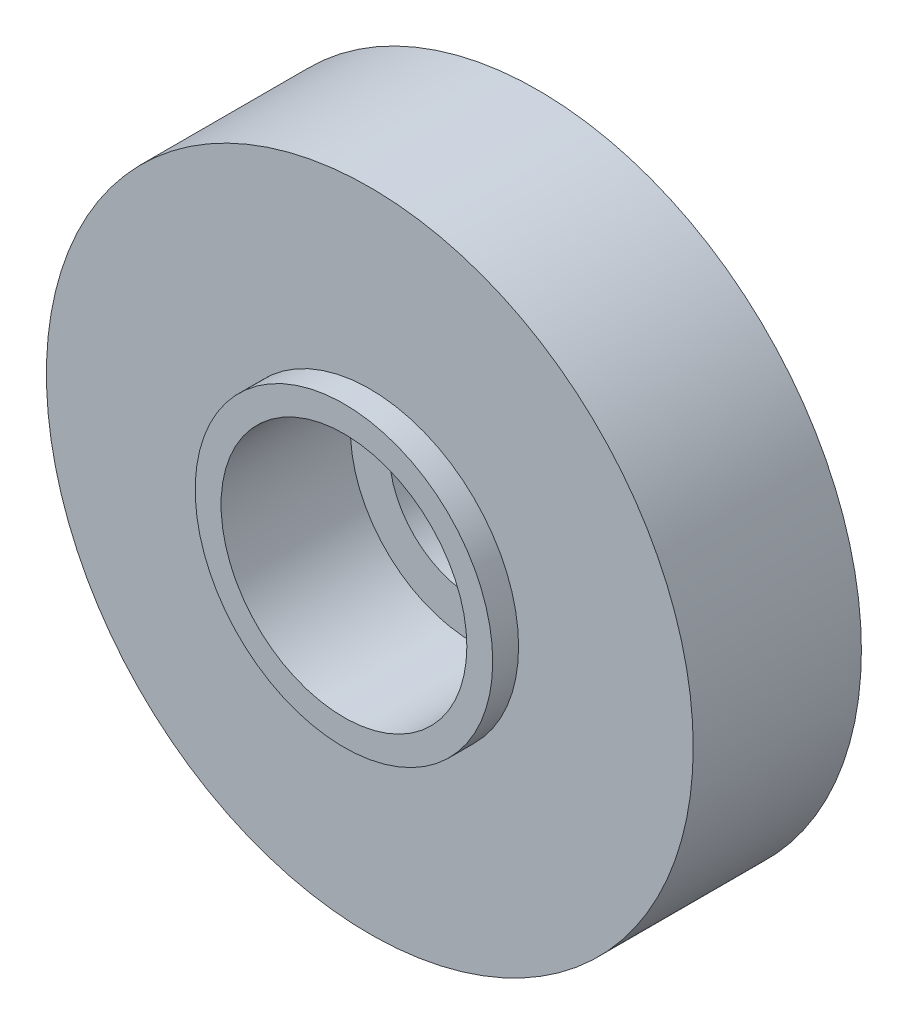
from build123d import *

# Parameters (mm, degrees)
CROQUIS1_R              = 25
SALIENTE_EXTRUIR1_DEPTH = 13
CROQUIS2_R              = 11.5
SALIENTE_EXTRUIR2_DEPTH = 2
CROQUIS3_R              = 9.5
CORTAR_EXTRUIR1_DEPTH   = 10
CROQUIS4_R              = 6.5
CORTAR_EXTRUIR2_DEPTH   = 37.742346142


with BuildPart() as part:
    # Croquis1 → Saliente-Extruir1 (new body)
    with BuildSketch(Plane.XY):
        Circle(CROQUIS1_R)
    extrude(amount=-SALIENTE_EXTRUIR1_DEPTH)

    # Croquis2 → Saliente-Extruir2 (add)
    with BuildSketch(Plane.XY):
        Circle(CROQUIS2_R)
    extrude(amount=SALIENTE_EXTRUIR2_DEPTH)

    # Croquis3 → Cortar-Extruir1 (cut)
    with BuildSketch(Plane.XY.offset(2)):
        Circle(CROQUIS3_R)
    extrude(amount=-CORTAR_EXTRUIR1_DEPTH, mode=Mode.SUBTRACT)

    # Croquis4 → Cortar-Extruir2 (cut, through all)
    with BuildSketch(Plane.XY.offset(-8)):
        Circle(CROQUIS4_R)
    extrude(amount=-CORTAR_EXTRUIR2_DEPTH, mode=Mode.SUBTRACT)


solid = part.part
